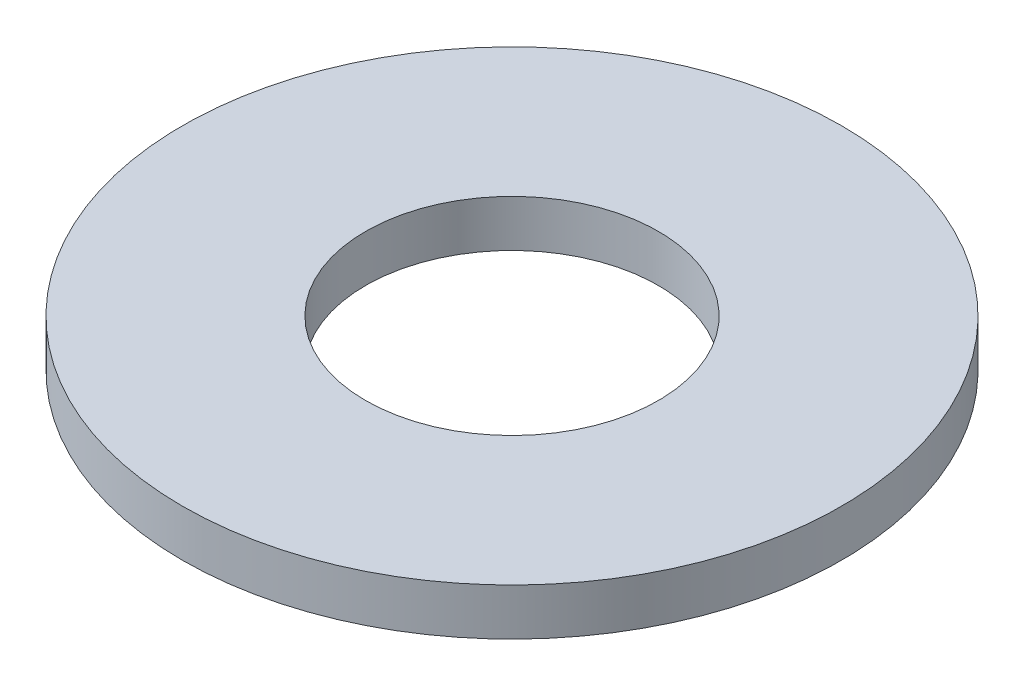
from build123d import *

# Parameters (mm, degrees)
SKETCH1_R           = 7.14375
SKETCH1_R_2         = 3.175
BOSS_EXTRUDE1_DEPTH = 1.016


with BuildPart() as part:
    # Sketch1 → Boss-Extrude1 (new body)
    with BuildSketch(Plane(origin=(0, 0, 0), x_dir=(1, 0, 0), z_dir=(0, 1, 0))):
        with Locations(Location((0, 0, 0), (0, 0, 270))):
            Circle(SKETCH1_R)
        with Locations(Location((0, 0, 0), (0, 0, 270))):
            Circle(SKETCH1_R_2, mode=Mode.SUBTRACT)
    extrude(amount=BOSS_EXTRUDE1_DEPTH)


solid = part.part
